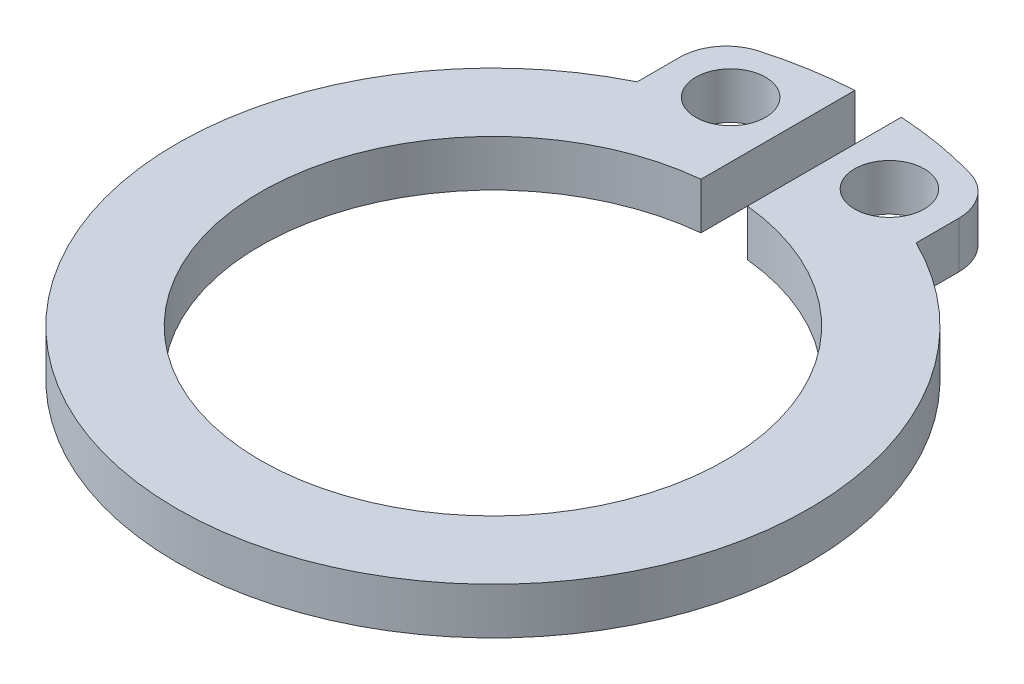
from build123d import *

# Parameters (mm, degrees)
SKETCH1_R           = 6.8
SKETCH1_R_2         = 5
BOSS_EXTRUDE1_DEPTH = 1
BOSS_EXTRUDE2_DEPTH = 1
FILLET1_R           = 1
SKETCH3_W           = 1
SKETCH3_H           = 3.309988885
CUT_EXTRUDE1_DEPTH  = 11.764757313
SKETCH4_R           = 0.75
CUT_EXTRUDE2_DEPTH  = 11.764757313


with BuildPart() as part:
    # Sketch1 → Boss-Extrude1 (new body)
    with BuildSketch(Plane(origin=(0, 0, 0), x_dir=(1, 0, 0), z_dir=(0, 1, 0))):
        with Locations(Location((0, 0, 0), (0, 0, 270))):
            Circle(SKETCH1_R)
        with Locations(Location((0, 0, 0), (0, 0, 270))):
            Circle(SKETCH1_R_2, mode=Mode.SUBTRACT)
    extrude(amount=BOSS_EXTRUDE1_DEPTH)

    # Sketch2 → Boss-Extrude2 (add)
    with BuildSketch(Plane.XZ):
        with BuildLine():
            Line((3, -7.738862966), (3, -6.102458521))
            ThreePointArc((3, -6.102458521), (1.782640126, -6.562179073), (0.5, -6.781592733))
            Line((0.5, -6.781592733), (0.5, -8.284926071))
            ThreePointArc((0.5, -8.284926071), (1.771170864, -8.108819505), (3, -7.738862966))
        make_face()
        with BuildLine():
            Line((-0.5, -8.284926071), (-0.5, -6.781592733))
            ThreePointArc((-0.5, -6.781592733), (-1.782640126, -6.562179073), (-3, -6.102458521))
            Line((-3, -6.102458521), (-3, -7.738862966))
            ThreePointArc((-3, -7.738862966), (-1.771170864, -8.108819505), (-0.5, -8.284926071))
        make_face()
    extrude(amount=-BOSS_EXTRUDE2_DEPTH)

    # Fillet1
    fillet1_edges = [part.edges().sort_by_distance(p)[0] for p in [
        (3, 0.5, -7.738862966),
        (-3, 0.5, -7.738862966),
    ]]
    fillet(fillet1_edges, radius=FILLET1_R)

    # Sketch3 → Cut-Extrude1 (cut, through all)
    with BuildSketch(Plane.XZ):
        with Locations((0, -6.629931629)):
            Rectangle(SKETCH3_W, SKETCH3_H)
    extrude(amount=-CUT_EXTRUDE1_DEPTH, mode=Mode.SUBTRACT)

    # Sketch4 → Cut-Extrude2 (cut, through all)
    with BuildSketch(Plane.XZ):
        with Locations(Location((1.707693317, -6.821038057, 0), (0, 0, 270))):
            Circle(SKETCH4_R)
        with Locations(Location((-1.707693317, -6.821038057, 0), (0, 0, 90))):
            Circle(SKETCH4_R)
    extrude(amount=-CUT_EXTRUDE2_DEPTH, mode=Mode.SUBTRACT)


solid = part.part
